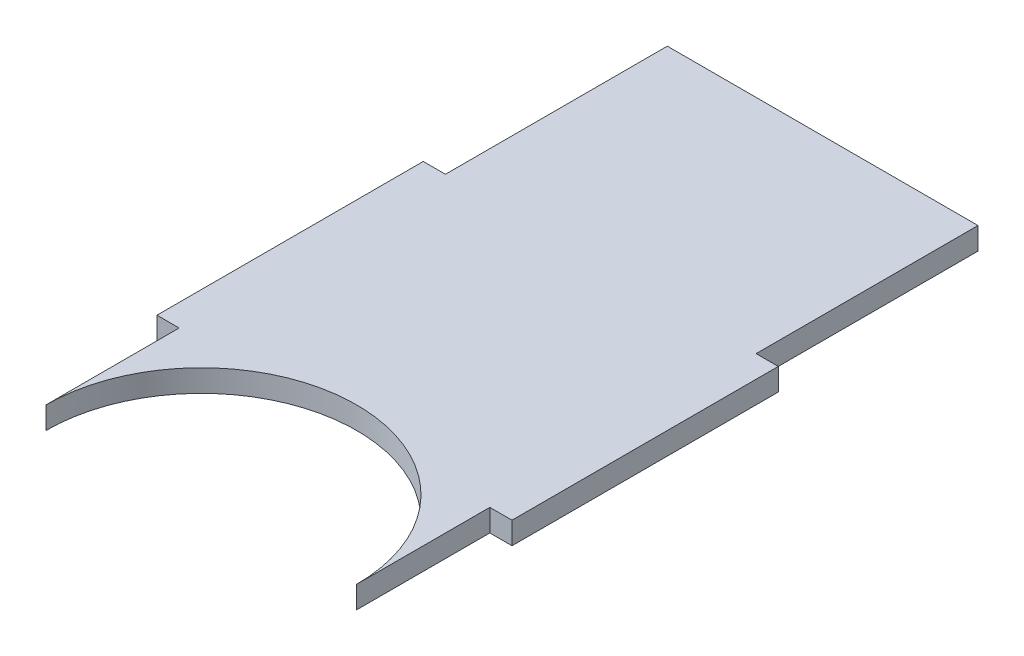
from build123d import *

# Parameters (mm, degrees)
SKETCH1_W           = 1.5875
SKETCH1_H           = 19.05
BOSS_EXTRUDE1_DEPTH = 1.5875


with BuildPart() as part:
    # Sketch1 → Boss-Extrude1 (new body)
    with BuildSketch(Plane(origin=(0, 0, 0), x_dir=(1, 0, 0), z_dir=(0, 1, 0))):
        with BuildLine():
            Line((11.1125, 9.525), (11.1125, 25.4))
            Line((11.1125, 25.4), (-11.1125, 25.4))
            Line((-11.1125, 25.4), (-11.1125, 9.525))
            Line((-11.1125, 9.525), (-11.1125, -9.525))
            Line((-11.1125, -9.525), (-11.1125, -19.05))
            ThreePointArc((-11.1125, -19.05), (0, -7.9375), (11.1125, -19.05))
            Line((11.1125, -19.05), (11.1125, -9.525))
            Line((11.1125, -9.525), (11.1125, 9.525))
        make_face()
        with Locations((11.90625, 0)):
            Rectangle(SKETCH1_W, SKETCH1_H)
        with Locations((-11.90625, 0)):
            Rectangle(SKETCH1_W, SKETCH1_H)
    extrude(amount=BOSS_EXTRUDE1_DEPTH)


solid = part.part
